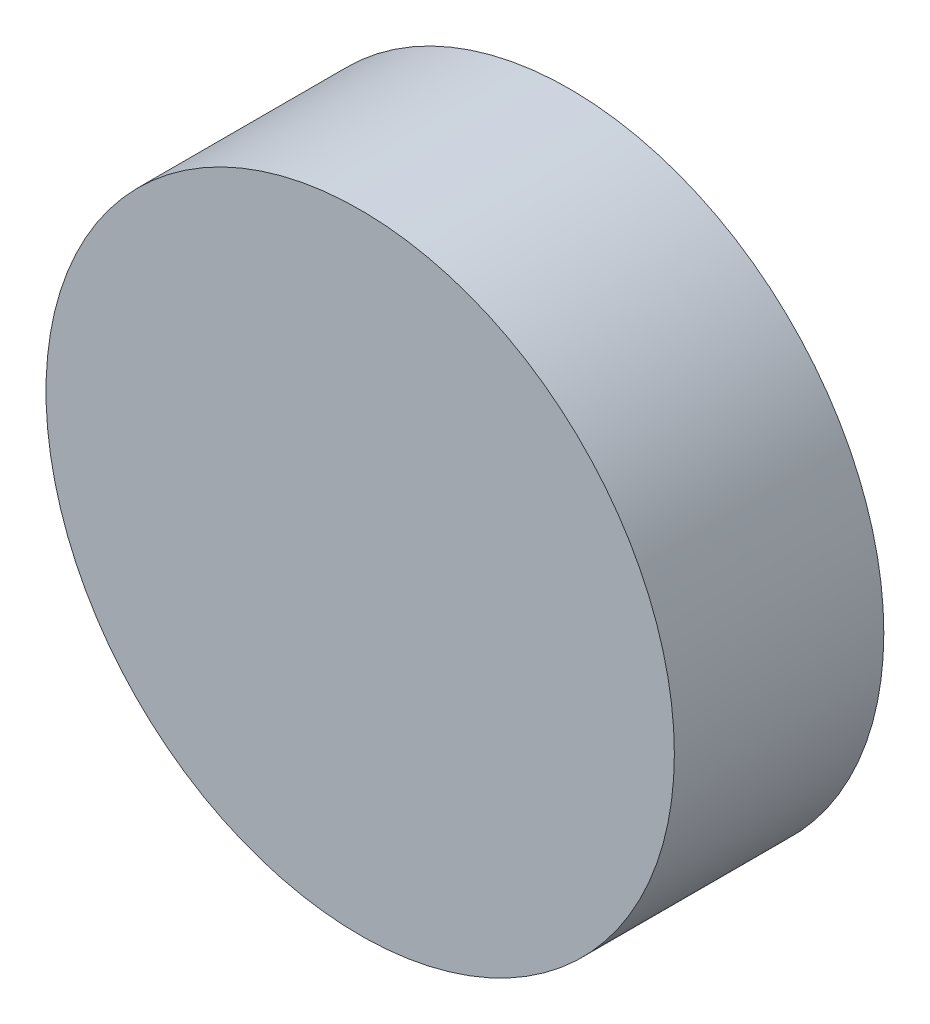
from build123d import *

# Parameters (mm, degrees)
SKETCH1_R           = 38.1
BOSS_EXTRUDE1_DEPTH = 25.4


with BuildPart() as part:
    # Sketch1 → Boss-Extrude1 (new body)
    with BuildSketch(Plane.XY):
        Circle(SKETCH1_R)
    extrude(amount=BOSS_EXTRUDE1_DEPTH)


solid = part.part
